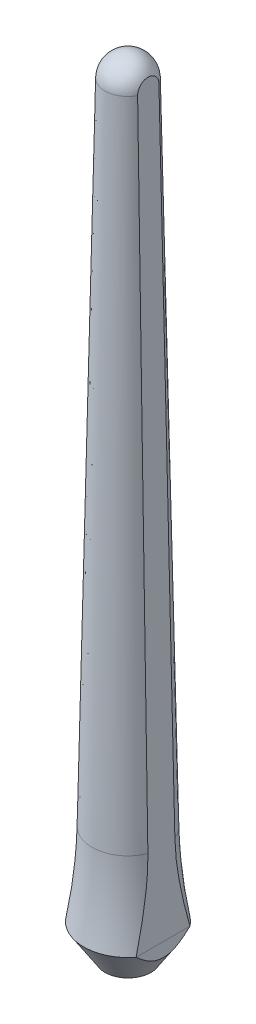
from build123d import *

# Parameters (mm, degrees)
SKETCH2_R          = 2.2
CUT_EXTRUDE1_DEPTH = 12
CUT_EXTRUDE2_DEPTH = 10
CHAMFER1_SIZE      = 0.2
CHAMFER1_SIZE2     = 0.746410162
CHAMFER2_SIZE      = 0.5


with BuildPart() as part:
    # Sketch1 → Revolve1 (revolve)
    with BuildSketch(Plane.XY, mode=Mode.PRIVATE) as revolve1_sk:
        with BuildLine():
            Line((0, 0), (0, 120))
            ThreePointArc((0, 120), (2.450254417, 118.999536357), (3.5, 116.569987341))
            Line((3.5, 116.569987341), (5.5, 17.561999145))
            ThreePointArc((5.5, 17.561999145), (5.876826993, 11.256304757), (6.75, 5))
            Line((6.75, 5), (3.5, 0))
            Line((3.5, 0), (0, 0))
        make_face()
    revolve(revolve1_sk.sketch.rotate(Axis((0, 0, 0), (0, -1, 0)), 90), axis=Axis((0, 0, 0), (0, -1, 0)))

    # Sketch2 → Cut-Extrude1 (cut)
    with BuildSketch(Plane.XZ):
        with Locations(Location((0, 0, 0), (0, 0, 270))):
            Circle(SKETCH2_R)
    extrude(amount=-CUT_EXTRUDE1_DEPTH, mode=Mode.SUBTRACT)

    # Sketch3 → Cut-Extrude2 (cut, symmetric)
    with BuildSketch(Plane.XY):
        Polygon((2.8286269, 130), (5.858685439, -20), (20, -20), (20, 130), align=None)
    extrude(amount=CUT_EXTRUDE2_DEPTH, both=True, mode=Mode.SUBTRACT)

    # Chamfer1
    chamfer1_edges = [part.edges().sort_by_distance(p)[0] for p in [
        (0, 0, 2.2),
    ]]
    chamfer1_side = [part.faces().sort_by_distance(p)[0] for p in [
        (0, 0, -3.401005051),
    ]]
    chamfer(chamfer1_edges, length=CHAMFER1_SIZE, length2=CHAMFER1_SIZE2, reference=chamfer1_side[0])


with BuildPart() as body_2:
    # Split1: the piece on the far side of the plane
    add(part.part)
    split(bisect_by=Plane(origin=(0, 5, 0), x_dir=(0, 0, -1), z_dir=(0, -1, 0)), keep=Keep.BOTTOM)

    # Chamfer2
    chamfer2_edges = [body_2.edges().sort_by_distance(p)[0] for p in [
        (0, 12, 2.2),
    ]]
    chamfer(chamfer2_edges, length=CHAMFER2_SIZE)


with BuildPart() as part_1:
    add(part.part)

    # Split1
    split(bisect_by=Plane(origin=(0, 5, 0), x_dir=(0, 0, -1), z_dir=(0, -1, 0)), keep=Keep.TOP)


solid = Compound([body_2.part, part_1.part])
